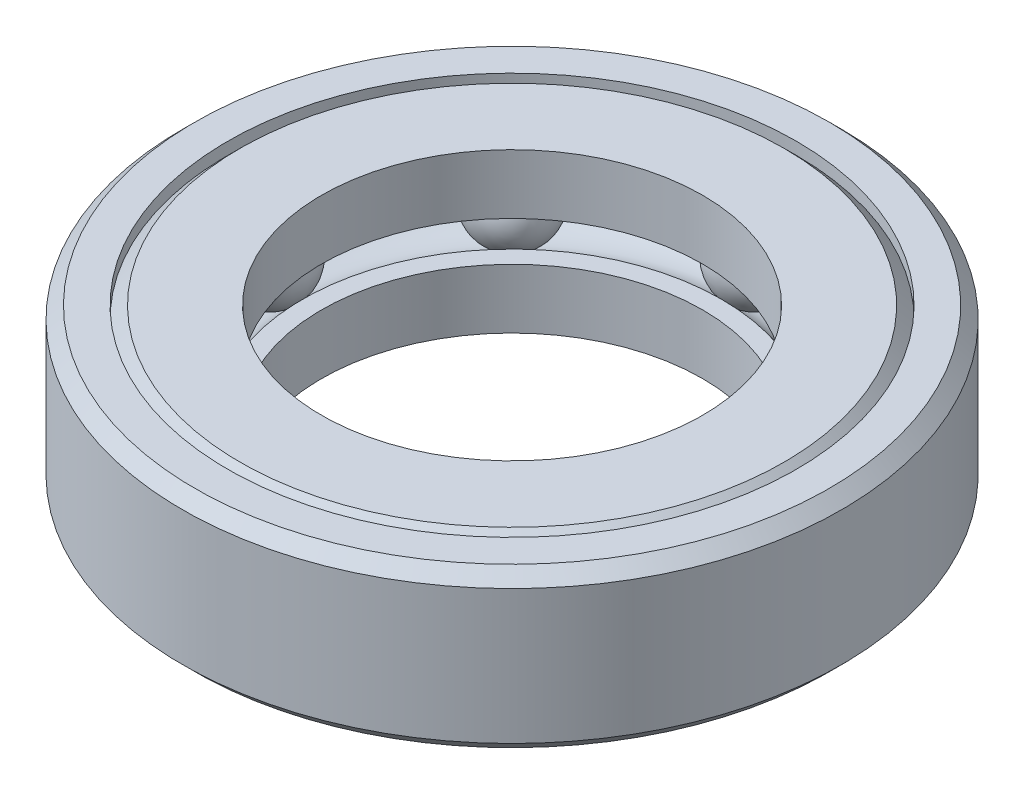
from build123d import *

# Parameters (mm, degrees)
CIRPATTERN1_COUNT = 8


with BuildPart() as part:
    # Sketch2 → Revolve1 (revolve)
    with BuildSketch(Plane(origin=(0, 0, 0), x_dir=(0, 0, -1), z_dir=(1, 0, 0)), mode=Mode.PRIVATE) as revolve1_sk:
        with BuildLine():
            Line((-27.785319571, 1.984375), (-29.6465625, 1.984375))
            Line((-29.6465625, 1.984375), (-29.6465625, 5.471634886))
            Line((-29.6465625, 5.471634886), (-27.180697386, 7.9375))
            Line((-27.180697386, 7.9375), (-19.05, 7.9375))
            Line((-19.05, 7.9375), (-19.05, 1.984375))
            Line((-19.05, 1.984375), (-20.911242929, 1.984375))
            ThreePointArc((-20.911242929, 1.984375), (-24.34828125, 3.96875), (-27.785319571, 1.984375))
        make_face()
        with BuildLine():
            Line((-19.05, -1.984375), (-20.911242929, -1.984375))
            ThreePointArc((-20.911242929, -1.984375), (-24.34828125, -3.96875), (-27.785319571, -1.984375))
            Line((-27.785319571, -1.984375), (-29.6465625, -1.984375))
            Line((-29.6465625, -1.984375), (-29.6465625, -5.471634886))
            Line((-29.6465625, -5.471634886), (-27.180697386, -7.9375))
            Line((-27.180697386, -7.9375), (-19.05, -7.9375))
            Line((-19.05, -7.9375), (-19.05, -1.984375))
        make_face()
    revolve(revolve1_sk.sketch.rotate(Axis((0, -7.9375, 0), (0, 1, 0)), 180), axis=Axis((0, -7.9375, 0), (0, 1, 0)))


with BuildPart() as body_2:
    # Sketch3 → Revolve2 (revolve)
    with BuildSketch(Plane(origin=(0, 0, 0), x_dir=(0, 0, -1), z_dir=(1, 0, 0)), mode=Mode.PRIVATE) as revolve2_sk:
        Polygon((-28.413629943, 6.704567443), (-28.413629943, 7.9375), (-31.707692443, 7.9375), (-32.940625, 6.704567443), (-32.940625, -6.704567443), (-31.707692443, -7.9375), (-28.413629943, -7.9375), (-28.413629943, -6.704567443), (-29.6465625, -5.471634886), (-29.6465625, 5.471634886), align=None)
    revolve(revolve2_sk.sketch.rotate(Axis((0, -7.9375, 0), (0, 1, 0)), 180), axis=Axis((0, -7.9375, 0), (0, 1, 0)))


with BuildPart() as body_3:
    # Sketch4 → Revolve3 (revolve)
    with BuildSketch(Plane(origin=(0, 0, 0), x_dir=(0, 0, -1), z_dir=(1, 0, 0))):
        with BuildLine():
            Line((-24.34828125, 3.96875), (-24.34828125, -3.96875))
            ThreePointArc((-24.34828125, -3.96875), (-20.37953125, 0), (-24.34828125, 3.96875))
        make_face()
    revolve(axis=Axis((0, 3.96875, 24.34828125), (0, -1, 0)))


with BuildPart() as cirpattern1_1:
    # CirPattern1: pattern copy
    add(body_3.part.rotate(Axis((0, 0, 0), (0, 1, 0)), 1 * 360 / CIRPATTERN1_COUNT))


with BuildPart() as cirpattern1_2:
    # CirPattern1: pattern copy
    add(body_3.part.rotate(Axis((0, 0, 0), (0, 1, 0)), 2 * 360 / CIRPATTERN1_COUNT))


with BuildPart() as cirpattern1_3:
    # CirPattern1: pattern copy
    add(body_3.part.rotate(Axis((0, 0, 0), (0, 1, 0)), 3 * 360 / CIRPATTERN1_COUNT))


with BuildPart() as cirpattern1_4:
    # CirPattern1: pattern copy
    add(body_3.part.rotate(Axis((0, 0, 0), (0, 1, 0)), 4 * 360 / CIRPATTERN1_COUNT))


with BuildPart() as cirpattern1_5:
    # CirPattern1: pattern copy
    add(body_3.part.rotate(Axis((0, 0, 0), (0, 1, 0)), 5 * 360 / CIRPATTERN1_COUNT))


with BuildPart() as cirpattern1_6:
    # CirPattern1: pattern copy
    add(body_3.part.rotate(Axis((0, 0, 0), (0, 1, 0)), 6 * 360 / CIRPATTERN1_COUNT))


with BuildPart() as cirpattern1_7:
    # CirPattern1: pattern copy
    add(body_3.part.rotate(Axis((0, 0, 0), (0, 1, 0)), 7 * 360 / CIRPATTERN1_COUNT))


solid = Compound([part.part, body_2.part, body_3.part, cirpattern1_1.part, cirpattern1_2.part, cirpattern1_3.part, cirpattern1_4.part, cirpattern1_5.part, cirpattern1_6.part, cirpattern1_7.part])
